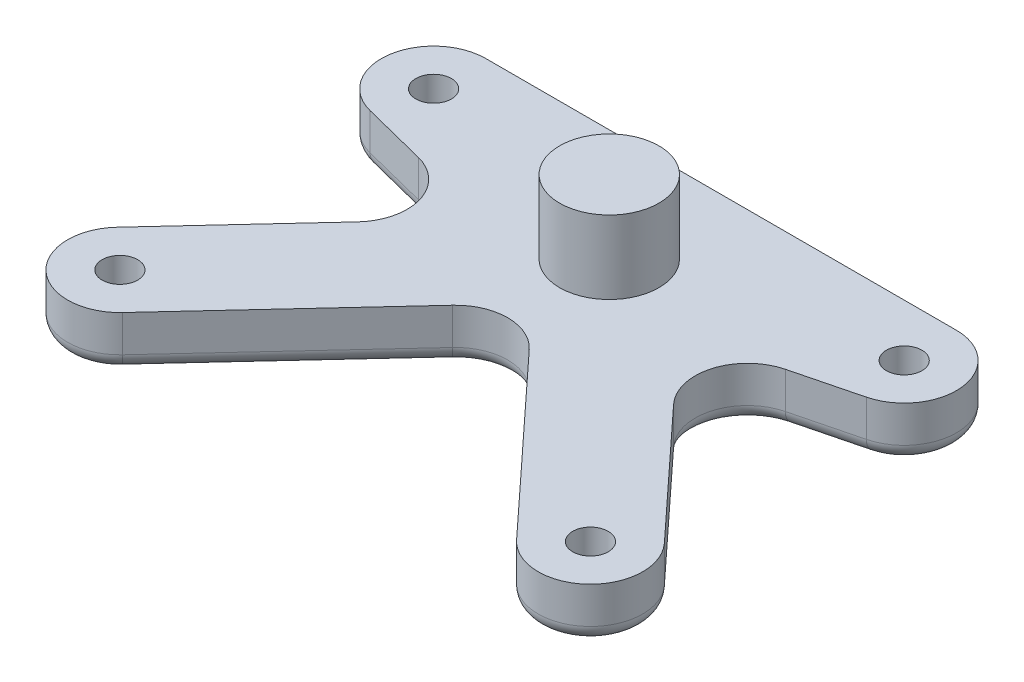
from build123d import *

# Parameters (mm, degrees)
SKETCH1_R           = 1.7
BOSS_EXTRUDE1_DEPTH = 5
SKETCH2_R           = 4.75
BOSS_EXTRUDE2_DEPTH = 7
FILLET1_R           = 1.5


with BuildPart() as part:
    # Sketch1 → Boss-Extrude1 (new body)
    with BuildSketch(Plane(origin=(0, 0, 0), x_dir=(1, 0, 0), z_dir=(0, 1, 0))):
        with BuildLine():
            Line((-26.16880337, -11.602959843), (-15.107142779, 0.343633596))
            ThreePointArc((-15.107142779, 0.343633596), (-13.981683241, 5.160195913), (-17.548068062, 8.58756094))
            Line((-17.548068062, 8.58756094), (-23.727878087, 10.153112813))
            ThreePointArc((-23.727878087, 10.153112813), (-27.461574142, 15.618693812), (-22.5, 20))
            Line((-22.5, 20), (22.5, 20))
            ThreePointArc((22.5, 20), (27.461574142, 15.618693812), (23.727878087, 10.153112813))
            Line((23.727878087, 10.153112813), (17.548068062, 8.58756094))
            ThreePointArc((17.548068062, 8.58756094), (13.981683241, 5.160195913), (15.107142779, 0.343633596))
            Line((15.107142779, 0.343633596), (26.16880337, -11.602959843))
            ThreePointArc((26.16880337, -11.602959843), (25.897040157, -18.66880337), (18.83119663, -18.397040157))
            Line((18.83119663, -18.397040157), (3.66880337, -2.021655437))
            ThreePointArc((3.66880337, -2.021655437), (0, -0.418695594), (-3.66880337, -2.021655437))
            Line((-3.66880337, -2.021655437), (-18.83119663, -18.397040157))
            ThreePointArc((-18.83119663, -18.397040157), (-25.897040157, -18.66880337), (-26.16880337, -11.602959843))
        make_face()
        with Locations(Location((22.5, 15, 0), (0, 0, 270))):
            Circle(SKETCH1_R, mode=Mode.SUBTRACT)
        with Locations(Location((22.5, -15, 0), (0, 0, 270))):
            Circle(SKETCH1_R, mode=Mode.SUBTRACT)
        with Locations(Location((-22.5, 15, 0), (0, 0, 270))):
            Circle(SKETCH1_R, mode=Mode.SUBTRACT)
        with Locations(Location((-22.5, -15, 0), (0, 0, 270))):
            Circle(SKETCH1_R, mode=Mode.SUBTRACT)
    extrude(amount=BOSS_EXTRUDE1_DEPTH)

    # Sketch2 → Boss-Extrude2 (add)
    with BuildSketch(Plane(origin=(0, 5, 0), x_dir=(1, 0, 0), z_dir=(0, 1, 0))):
        with Locations(Location((0, 9.3, 0), (0, 0, 270))):
            Circle(SKETCH2_R)
    extrude(amount=BOSS_EXTRUDE2_DEPTH)

    # Fillet1
    fillet1_edges = [part.edges().sort_by_distance(p)[0] for p in [
        (-20.637973075, 0, 5.629663123),
        (-13.981683241, 0, -5.160195913),
        (-20.637973075, 0, -9.370336877),
        (-27.461574142, 0, -15.618693812),
        (0, 0, -20),
        (27.461574142, 0, -15.618693812),
        (20.637973075, 0, -9.370336877),
        (13.981683241, 0, -5.160195913),
        (20.637973075, 0, 5.629663123),
        (25.897040157, 0, 18.66880337),
        (11.25, 0, 10.209347797),
        (0, 0, 0.418695594),
        (-11.25, 0, 10.209347797),
        (-25.897040157, 0, 18.66880337),
    ]]
    fillet(fillet1_edges, radius=FILLET1_R)


solid = part.part
